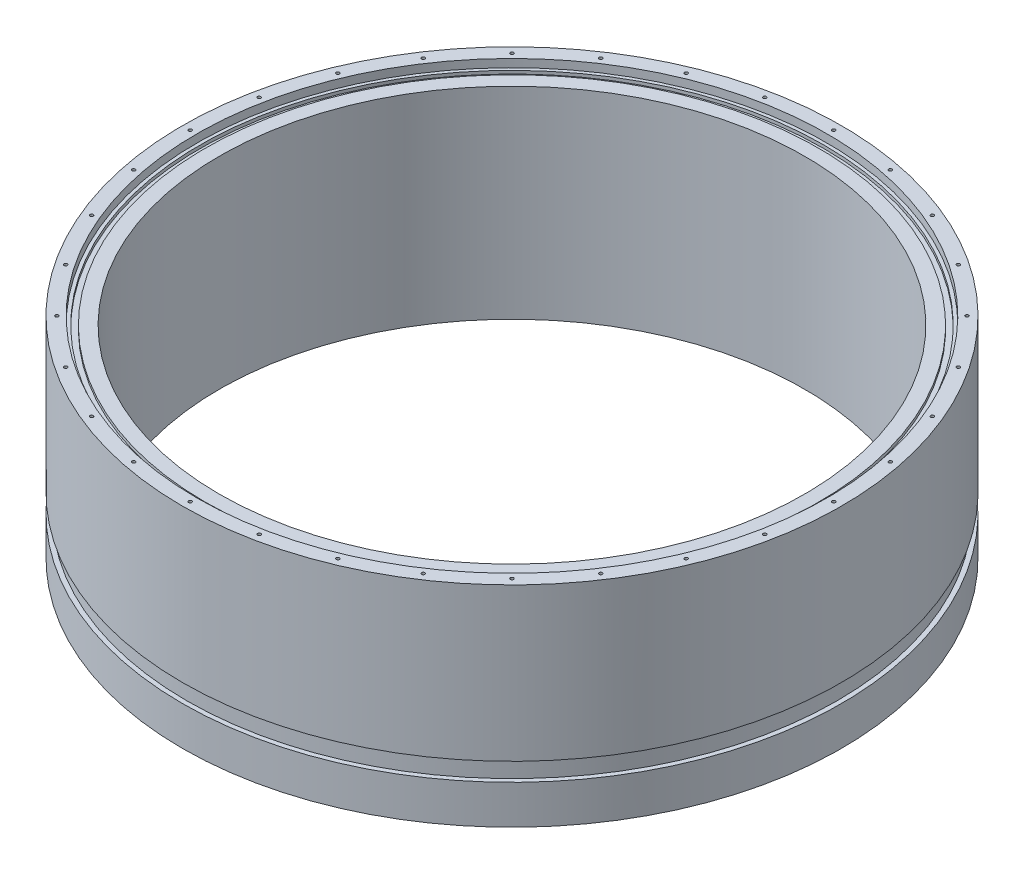
from build123d import *

# Parameters (mm, degrees)
SKETCH2_W                 = 4.1656
SKETCH2_H                 = 2.413
CIRPATTERN1_COUNT         = 32
F_5_0MM_DOWEL_HOLE1_D     = 5.05
F_5_0MM_DOWEL_HOLE1_DEPTH = 19.5
F_5_0MM_DOWEL_HOLE1_TIP   = 1.517173063
SKETCH7_W                 = 3.5
SKETCH7_H                 = 14


with BuildPart() as part:
    # Sketch1 → Revolve1 (revolve)
    with BuildSketch(Plane.XY, mode=Mode.PRIVATE) as revolve1_sk:
        Polygon((225.6, 74.685), (243, 74.685), (243, 80.885), (254, 80.885), (254, -80.885), (225.6, -80.885), align=None)
    revolve(revolve1_sk.sketch.rotate(Axis((0, 80.885, 0), (0, -1, 0)), 90), axis=Axis((0, 80.885, 0), (0, -1, 0)))

    # Sketch2 → Cut-Revolve1 (revolve, cut)
    with BuildSketch(Plane.XY, mode=Mode.PRIVATE) as cut_revolve1_sk:
        with Locations((238.4172, 73.4785)):
            Rectangle(SKETCH2_W, SKETCH2_H)
    revolve(cut_revolve1_sk.sketch.rotate(Axis((0, 80.885, 0), (0, -1, 0)), 90), axis=Axis((0, 80.885, 0), (0, -1, 0)), mode=Mode.SUBTRACT)

    # Sketch4 → M3x0.5 Tapped Hole1 (revolve, cut)
    with BuildSketch(Plane(origin=(248, 80.885, 0), x_dir=(0, 0, 1), z_dir=(1, 0, 0))):
        Polygon((0, 0), (0, 10.251075774), (1.25, 9.5), (1.25, 0), align=None)
    m3x0_5_tapped_hole1 = revolve(axis=Axis((248, 87.235, 0), (0, -1, 0)), mode=Mode.SUBTRACT)

    # CirPattern1: M3x0.5 Tapped Hole1 ×32 about axis
    cirpattern1_axis = Axis((0, 0, 0), (0, 1, 0))
    for i in range(1, CIRPATTERN1_COUNT):
        add(m3x0_5_tapped_hole1.rotate(cirpattern1_axis, i * 360 / CIRPATTERN1_COUNT), mode=Mode.SUBTRACT)

    # Mirror1: M3x0.5 Tapped Hole1 across plane
    add(m3x0_5_tapped_hole1.mirror(Plane.ZX), mode=Mode.SUBTRACT)

    # Mirror1 copy 1 sketch → Mirror1 copy 1 (revolve, cut)
    with BuildSketch(Plane(origin=(243.23474954, -80.885, -48.38239986), x_dir=(0.19509032201612825, 0, 0.9807852804032304), z_dir=(0.9807852804032304, 0, -0.19509032201612825))):
        Polygon((0, 0), (0, -10.251075774), (1.25, -9.5), (1.25, 0), align=None)
    revolve(axis=Axis((243.23474954, -87.235, -48.38239986), (0, -1, 0)), mode=Mode.SUBTRACT)

    # Mirror1 copy 2 sketch → Mirror1 copy 2 (revolve, cut)
    with BuildSketch(Plane(origin=(229.122124063, -80.885, -94.905491227), x_dir=(0.3826834323650898, 0, 0.9238795325112867), z_dir=(0.9238795325112867, 0, -0.3826834323650898))):
        Polygon((0, 0), (0, -10.251075774), (1.25, -9.5), (1.25, 0), align=None)
    revolve(axis=Axis((229.122124063, -87.235, -94.905491227), (0, -1, 0)), mode=Mode.SUBTRACT)

    # Mirror1 copy 3 sketch → Mirror1 copy 3 (revolve, cut)
    with BuildSketch(Plane(origin=(206.204463851, -80.885, -137.781417789), x_dir=(0.5555702330196022, 0, 0.8314696123025452), z_dir=(0.8314696123025452, 0, -0.5555702330196022))):
        Polygon((0, 0), (0, -10.251075774), (1.25, -9.5), (1.25, 0), align=None)
    revolve(axis=Axis((206.204463851, -87.235, -137.781417789), (0, -1, 0)), mode=Mode.SUBTRACT)

    # Mirror1 copy 4 sketch → Mirror1 copy 4 (revolve, cut)
    with BuildSketch(Plane(origin=(175.362481734, -80.885, -175.362481734), x_dir=(0.7071067811865475, 0, 0.7071067811865476), z_dir=(0.7071067811865476, 0, -0.7071067811865475))):
        Polygon((0, 0), (0, -10.251075774), (1.25, -9.5), (1.25, 0), align=None)
    revolve(axis=Axis((175.362481734, -87.235, -175.362481734), (0, -1, 0)), mode=Mode.SUBTRACT)

    # Mirror1 copy 5 sketch → Mirror1 copy 5 (revolve, cut)
    with BuildSketch(Plane(origin=(137.781417789, -80.885, -206.204463851), x_dir=(0.8314696123025452, 0, 0.5555702330196023), z_dir=(0.5555702330196023, 0, -0.8314696123025452))):
        Polygon((0, 0), (0, -10.251075774), (1.25, -9.5), (1.25, 0), align=None)
    revolve(axis=Axis((137.781417789, -87.235, -206.204463851), (0, -1, 0)), mode=Mode.SUBTRACT)

    # Mirror1 copy 6 sketch → Mirror1 copy 6 (revolve, cut)
    with BuildSketch(Plane(origin=(94.905491227, -80.885, -229.122124063), x_dir=(0.9238795325112867, 0, 0.38268343236508984), z_dir=(0.38268343236508984, 0, -0.9238795325112867))):
        Polygon((0, 0), (0, -10.251075774), (1.25, -9.5), (1.25, 0), align=None)
    revolve(axis=Axis((94.905491227, -87.235, -229.122124063), (0, -1, 0)), mode=Mode.SUBTRACT)

    # Mirror1 copy 7 sketch → Mirror1 copy 7 (revolve, cut)
    with BuildSketch(Plane(origin=(48.38239986, -80.885, -243.23474954), x_dir=(0.9807852804032304, 0, 0.19509032201612833), z_dir=(0.19509032201612833, 0, -0.9807852804032304))):
        Polygon((0, 0), (0, -10.251075774), (1.25, -9.5), (1.25, 0), align=None)
    revolve(axis=Axis((48.38239986, -87.235, -243.23474954), (0, -1, 0)), mode=Mode.SUBTRACT)

    # Mirror1 copy 8 sketch → Mirror1 copy 8 (revolve, cut)
    with BuildSketch(Plane(origin=(0, -80.885, -248), x_dir=(1, 0, 0), z_dir=(0, 0, -1))):
        Polygon((0, 0), (0, -10.251075774), (1.25, -9.5), (1.25, 0), align=None)
    revolve(axis=Axis((0, -87.235, -248), (0, -1, 0)), mode=Mode.SUBTRACT)

    # Mirror1 copy 9 sketch → Mirror1 copy 9 (revolve, cut)
    with BuildSketch(Plane(origin=(-48.38239986, -80.885, -243.23474954), x_dir=(0.9807852804032304, 0, -0.1950903220161282), z_dir=(-0.1950903220161282, 0, -0.9807852804032304))):
        Polygon((0, 0), (0, -10.251075774), (1.25, -9.5), (1.25, 0), align=None)
    revolve(axis=Axis((-48.38239986, -87.235, -243.23474954), (0, -1, 0)), mode=Mode.SUBTRACT)

    # Mirror1 copy 10 sketch → Mirror1 copy 10 (revolve, cut)
    with BuildSketch(Plane(origin=(-94.905491227, -80.885, -229.122124063), x_dir=(0.9238795325112867, 0, -0.3826834323650897), z_dir=(-0.3826834323650897, 0, -0.9238795325112867))):
        Polygon((0, 0), (0, -10.251075774), (1.25, -9.5), (1.25, 0), align=None)
    revolve(axis=Axis((-94.905491227, -87.235, -229.122124063), (0, -1, 0)), mode=Mode.SUBTRACT)

    # Mirror1 copy 11 sketch → Mirror1 copy 11 (revolve, cut)
    with BuildSketch(Plane(origin=(-137.781417789, -80.885, -206.204463851), x_dir=(0.8314696123025451, 0, -0.5555702330196023), z_dir=(-0.5555702330196023, 0, -0.8314696123025451))):
        Polygon((0, 0), (0, -10.251075774), (1.25, -9.5), (1.25, 0), align=None)
    revolve(axis=Axis((-137.781417789, -87.235, -206.204463851), (0, -1, 0)), mode=Mode.SUBTRACT)

    # Mirror1 copy 12 sketch → Mirror1 copy 12 (revolve, cut)
    with BuildSketch(Plane(origin=(-175.362481734, -80.885, -175.362481734), x_dir=(0.7071067811865476, 0, -0.7071067811865475), z_dir=(-0.7071067811865475, 0, -0.7071067811865476))):
        Polygon((0, 0), (0, -10.251075774), (1.25, -9.5), (1.25, 0), align=None)
    revolve(axis=Axis((-175.362481734, -87.235, -175.362481734), (0, -1, 0)), mode=Mode.SUBTRACT)

    # Mirror1 copy 13 sketch → Mirror1 copy 13 (revolve, cut)
    with BuildSketch(Plane(origin=(-206.204463851, -80.885, -137.781417789), x_dir=(0.5555702330196022, 0, -0.8314696123025453), z_dir=(-0.8314696123025453, 0, -0.5555702330196022))):
        Polygon((0, 0), (0, -10.251075774), (1.25, -9.5), (1.25, 0), align=None)
    revolve(axis=Axis((-206.204463851, -87.235, -137.781417789), (0, -1, 0)), mode=Mode.SUBTRACT)

    # Mirror1 copy 14 sketch → Mirror1 copy 14 (revolve, cut)
    with BuildSketch(Plane(origin=(-229.122124063, -80.885, -94.905491227), x_dir=(0.3826834323650899, 0, -0.9238795325112867), z_dir=(-0.9238795325112867, 0, -0.3826834323650899))):
        Polygon((0, 0), (0, -10.251075774), (1.25, -9.5), (1.25, 0), align=None)
    revolve(axis=Axis((-229.122124063, -87.235, -94.905491227), (0, -1, 0)), mode=Mode.SUBTRACT)

    # Mirror1 copy 15 sketch → Mirror1 copy 15 (revolve, cut)
    with BuildSketch(Plane(origin=(-243.23474954, -80.885, -48.38239986), x_dir=(0.19509032201612816, 0, -0.9807852804032304), z_dir=(-0.9807852804032304, 0, -0.19509032201612816))):
        Polygon((0, 0), (0, -10.251075774), (1.25, -9.5), (1.25, 0), align=None)
    revolve(axis=Axis((-243.23474954, -87.235, -48.38239986), (0, -1, 0)), mode=Mode.SUBTRACT)

    # Mirror1 copy 16 sketch → Mirror1 copy 16 (revolve, cut)
    with BuildSketch(Plane(origin=(-248, -80.885, 0), x_dir=(0, 0, -1), z_dir=(-1, 0, 0))):
        Polygon((0, 0), (0, -10.251075774), (1.25, -9.5), (1.25, 0), align=None)
    revolve(axis=Axis((-248, -87.235, 0), (0, -1, 0)), mode=Mode.SUBTRACT)

    # Mirror1 copy 17 sketch → Mirror1 copy 17 (revolve, cut)
    with BuildSketch(Plane(origin=(-243.23474954, -80.885, 48.38239986), x_dir=(-0.19509032201612836, 0, -0.9807852804032304), z_dir=(-0.9807852804032304, 0, 0.19509032201612836))):
        Polygon((0, 0), (0, -10.251075774), (1.25, -9.5), (1.25, 0), align=None)
    revolve(axis=Axis((-243.23474954, -87.235, 48.38239986), (0, -1, 0)), mode=Mode.SUBTRACT)

    # Mirror1 copy 18 sketch → Mirror1 copy 18 (revolve, cut)
    with BuildSketch(Plane(origin=(-229.122124063, -80.885, 94.905491227), x_dir=(-0.38268343236508967, 0, -0.9238795325112868), z_dir=(-0.9238795325112868, 0, 0.38268343236508967))):
        Polygon((0, 0), (0, -10.251075774), (1.25, -9.5), (1.25, 0), align=None)
    revolve(axis=Axis((-229.122124063, -87.235, 94.905491227), (0, -1, 0)), mode=Mode.SUBTRACT)

    # Mirror1 copy 19 sketch → Mirror1 copy 19 (revolve, cut)
    with BuildSketch(Plane(origin=(-206.204463851, -80.885, 137.781417789), x_dir=(-0.5555702330196023, 0, -0.8314696123025452), z_dir=(-0.8314696123025452, 0, 0.5555702330196023))):
        Polygon((0, 0), (0, -10.251075774), (1.25, -9.5), (1.25, 0), align=None)
    revolve(axis=Axis((-206.204463851, -87.235, 137.781417789), (0, -1, 0)), mode=Mode.SUBTRACT)

    # Mirror1 copy 20 sketch → Mirror1 copy 20 (revolve, cut)
    with BuildSketch(Plane(origin=(-175.362481734, -80.885, 175.362481734), x_dir=(-0.7071067811865475, 0, -0.7071067811865477), z_dir=(-0.7071067811865477, 0, 0.7071067811865475))):
        Polygon((0, 0), (0, -10.251075774), (1.25, -9.5), (1.25, 0), align=None)
    revolve(axis=Axis((-175.362481734, -87.235, 175.362481734), (0, -1, 0)), mode=Mode.SUBTRACT)

    # Mirror1 copy 21 sketch → Mirror1 copy 21 (revolve, cut)
    with BuildSketch(Plane(origin=(-137.781417789, -80.885, 206.204463851), x_dir=(-0.8314696123025452, 0, -0.5555702330196022), z_dir=(-0.5555702330196022, 0, 0.8314696123025452))):
        Polygon((0, 0), (0, -10.251075774), (1.25, -9.5), (1.25, 0), align=None)
    revolve(axis=Axis((-137.781417789, -87.235, 206.204463851), (0, -1, 0)), mode=Mode.SUBTRACT)

    # Mirror1 copy 22 sketch → Mirror1 copy 22 (revolve, cut)
    with BuildSketch(Plane(origin=(-94.905491227, -80.885, 229.122124063), x_dir=(-0.9238795325112868, 0, -0.3826834323650895), z_dir=(-0.3826834323650895, 0, 0.9238795325112868))):
        Polygon((0, 0), (0, -10.251075774), (1.25, -9.5), (1.25, 0), align=None)
    revolve(axis=Axis((-94.905491227, -87.235, 229.122124063), (0, -1, 0)), mode=Mode.SUBTRACT)

    # Mirror1 copy 23 sketch → Mirror1 copy 23 (revolve, cut)
    with BuildSketch(Plane(origin=(-48.38239986, -80.885, 243.23474954), x_dir=(-0.9807852804032303, 0, -0.19509032201612866), z_dir=(-0.19509032201612866, 0, 0.9807852804032303))):
        Polygon((0, 0), (0, -10.251075774), (1.25, -9.5), (1.25, 0), align=None)
    revolve(axis=Axis((-48.38239986, -87.235, 243.23474954), (0, -1, 0)), mode=Mode.SUBTRACT)

    # Mirror1 copy 24 sketch → Mirror1 copy 24 (revolve, cut)
    with BuildSketch(Plane(origin=(0, -80.885, 248), x_dir=(-1, 0, 0), z_dir=(0, 0, 1))):
        Polygon((0, 0), (0, -10.251075774), (1.25, -9.5), (1.25, 0), align=None)
    revolve(axis=Axis((0, -87.235, 248), (0, -1, 0)), mode=Mode.SUBTRACT)

    # Mirror1 copy 25 sketch → Mirror1 copy 25 (revolve, cut)
    with BuildSketch(Plane(origin=(48.38239986, -80.885, 243.23474954), x_dir=(-0.9807852804032304, 0, 0.1950903220161283), z_dir=(0.1950903220161283, 0, 0.9807852804032304))):
        Polygon((0, 0), (0, -10.251075774), (1.25, -9.5), (1.25, 0), align=None)
    revolve(axis=Axis((48.38239986, -87.235, 243.23474954), (0, -1, 0)), mode=Mode.SUBTRACT)

    # Mirror1 copy 26 sketch → Mirror1 copy 26 (revolve, cut)
    with BuildSketch(Plane(origin=(94.905491227, -80.885, 229.122124063), x_dir=(-0.9238795325112866, 0, 0.38268343236509), z_dir=(0.38268343236509, 0, 0.9238795325112866))):
        Polygon((0, 0), (0, -10.251075774), (1.25, -9.5), (1.25, 0), align=None)
    revolve(axis=Axis((94.905491227, -87.235, 229.122124063), (0, -1, 0)), mode=Mode.SUBTRACT)

    # Mirror1 copy 27 sketch → Mirror1 copy 27 (revolve, cut)
    with BuildSketch(Plane(origin=(137.781417789, -80.885, 206.204463851), x_dir=(-0.8314696123025455, 0, 0.5555702330196018), z_dir=(0.5555702330196018, 0, 0.8314696123025455))):
        Polygon((0, 0), (0, -10.251075774), (1.25, -9.5), (1.25, 0), align=None)
    revolve(axis=Axis((137.781417789, -87.235, 206.204463851), (0, -1, 0)), mode=Mode.SUBTRACT)

    # Mirror1 copy 28 sketch → Mirror1 copy 28 (revolve, cut)
    with BuildSketch(Plane(origin=(175.362481734, -80.885, 175.362481734), x_dir=(-0.7071067811865477, 0, 0.7071067811865474), z_dir=(0.7071067811865474, 0, 0.7071067811865477))):
        Polygon((0, 0), (0, -10.251075774), (1.25, -9.5), (1.25, 0), align=None)
    revolve(axis=Axis((175.362481734, -87.235, 175.362481734), (0, -1, 0)), mode=Mode.SUBTRACT)

    # Mirror1 copy 29 sketch → Mirror1 copy 29 (revolve, cut)
    with BuildSketch(Plane(origin=(206.204463851, -80.885, 137.781417789), x_dir=(-0.5555702330196022, 0, 0.8314696123025452), z_dir=(0.8314696123025452, 0, 0.5555702330196022))):
        Polygon((0, 0), (0, -10.251075774), (1.25, -9.5), (1.25, 0), align=None)
    revolve(axis=Axis((206.204463851, -87.235, 137.781417789), (0, -1, 0)), mode=Mode.SUBTRACT)

    # Mirror1 copy 30 sketch → Mirror1 copy 30 (revolve, cut)
    with BuildSketch(Plane(origin=(229.122124063, -80.885, 94.905491227), x_dir=(-0.38268343236508956, 0, 0.9238795325112868), z_dir=(0.9238795325112868, 0, 0.38268343236508956))):
        Polygon((0, 0), (0, -10.251075774), (1.25, -9.5), (1.25, 0), align=None)
    revolve(axis=Axis((229.122124063, -87.235, 94.905491227), (0, -1, 0)), mode=Mode.SUBTRACT)

    # Mirror1 copy 31 sketch → Mirror1 copy 31 (revolve, cut)
    with BuildSketch(Plane(origin=(243.23474954, -80.885, 48.38239986), x_dir=(-0.19509032201612872, 0, 0.9807852804032303), z_dir=(0.9807852804032303, 0, 0.19509032201612872))):
        Polygon((0, 0), (0, -10.251075774), (1.25, -9.5), (1.25, 0), align=None)
    revolve(axis=Axis((243.23474954, -87.235, 48.38239986), (0, -1, 0)), mode=Mode.SUBTRACT)

    # Ø5.0mm Dowel Hole1
    with Locations(Plane(origin=(0, -80.885, 0), x_dir=(-1, 0, 0), z_dir=(0, -1, 0))):
        with Locations((24.210233661, -245.810627488), (-24.210233661, 245.810627488)):
            Hole(F_5_0MM_DOWEL_HOLE1_D / 2, depth=F_5_0MM_DOWEL_HOLE1_DEPTH)
            with Locations((0, 0, -(F_5_0MM_DOWEL_HOLE1_DEPTH + F_5_0MM_DOWEL_HOLE1_TIP / 2))):  # 118° drill point
                Cone(0, F_5_0MM_DOWEL_HOLE1_D / 2, F_5_0MM_DOWEL_HOLE1_TIP, mode=Mode.SUBTRACT)

    # Sketch7 → groove (revolve, cut)
    with BuildSketch(Plane.XY, mode=Mode.PRIVATE) as groove_sk:
        with Locations((252.25, -43.885)):
            Rectangle(SKETCH7_W, SKETCH7_H)
    revolve(groove_sk.sketch.rotate(Axis((0, 0, 0), (0, 1, 0)), 270), axis=Axis((0, 0, 0), (0, 1, 0)), mode=Mode.SUBTRACT)


solid = part.part
